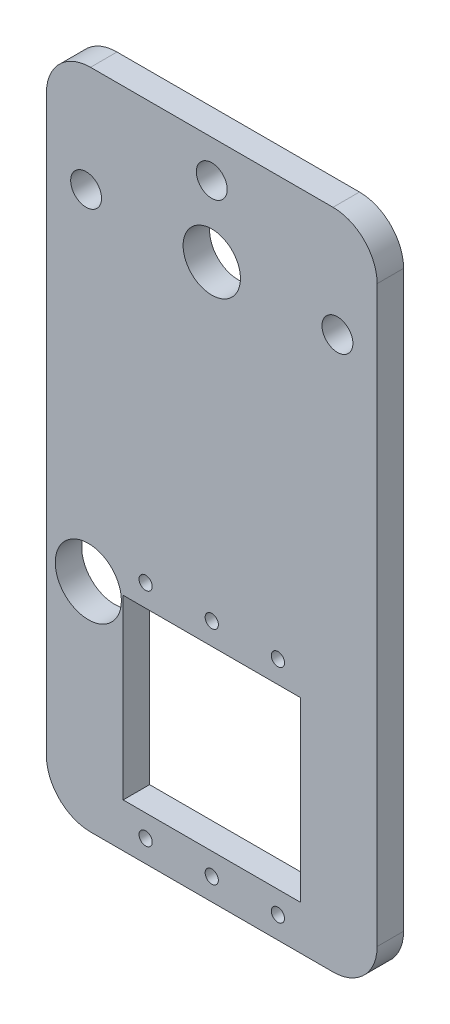
from build123d import *

# Parameters (mm, degrees)
CROQUIS2_W              = 75
CROQUIS2_H              = 150.2
CROQUIS2_R              = 3.5
CROQUIS2_R_2            = 1.5
CROQUIS2_R_3            = 6.5
CROQUIS2_W_2            = 40.2
CROQUIS2_H_2            = 40.2
SALIENTE_EXTRUIR1_DEPTH = 6
CROQUIS3_R              = 7.5
CORTAR_EXTRUIR1_DEPTH   = 13
REDONDEO1_R             = 10


with BuildPart() as part:
    # Croquis2 → Saliente-Extruir1 (new body)
    with BuildSketch(Plane.XY):
        Rectangle(CROQUIS2_W, CROQUIS2_H)
        with Locations((-28.5, 50.6)):
            Circle(CROQUIS2_R, mode=Mode.SUBTRACT)
        with Locations((28.5, 50.6)):
            Circle(CROQUIS2_R, mode=Mode.SUBTRACT)
        with Locations((0, 66.6)):
            Circle(CROQUIS2_R, mode=Mode.SUBTRACT)
        with Locations((0, -19.9)):
            Circle(CROQUIS2_R_2, mode=Mode.SUBTRACT)
        with Locations((-15, -19.9)):
            Circle(CROQUIS2_R_2, mode=Mode.SUBTRACT)
        with Locations((15, -19.9)):
            Circle(CROQUIS2_R_2, mode=Mode.SUBTRACT)
        with Locations((-15, -70.1)):
            Circle(CROQUIS2_R_2, mode=Mode.SUBTRACT)
        with Locations((0, -70.1)):
            Circle(CROQUIS2_R_2, mode=Mode.SUBTRACT)
        with Locations((15, -70.1)):
            Circle(CROQUIS2_R_2, mode=Mode.SUBTRACT)
        with Locations((0, 50.6)):
            Circle(CROQUIS2_R_3, mode=Mode.SUBTRACT)
        with Locations((0, -45)):
            Rectangle(CROQUIS2_W_2, CROQUIS2_H_2, mode=Mode.SUBTRACT)
    extrude(amount=-SALIENTE_EXTRUIR1_DEPTH)

    # Croquis3 → Cortar-Extruir1 (cut)
    with BuildSketch(Plane.XY):
        with Locations((-28, -26.156897814)):
            Circle(CROQUIS3_R)
    extrude(amount=-CORTAR_EXTRUIR1_DEPTH, mode=Mode.SUBTRACT)

    # Redondeo1
    redondeo1_edges = [part.edges().sort_by_distance(p)[0] for p in [
        (37.5, -75.1, -3),
        (-37.5, -75.1, -3),
        (-37.5, 75.1, -3),
        (37.5, 75.1, -3),
    ]]
    fillet(redondeo1_edges, radius=REDONDEO1_R)


solid = part.part
